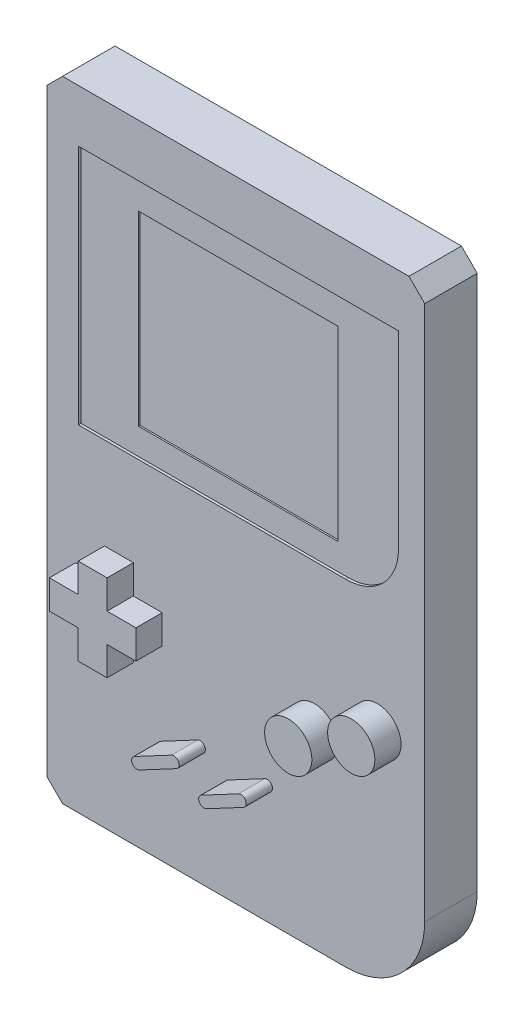
from build123d import *

# Parameters (mm, degrees)
SKETCH_1_R       = 4.5
EXTRUDE_10_DEPTH = 10
SKETCH_1_15_W    = 38
SKETCH_1_15_H    = 35.5
EXTRUDE_11_DEPTH = 9.5
SKETCH_1_16_W    = 38
SKETCH_1_16_H    = 35.5
EXTRUDE_12_DEPTH = 9.2
SKETCH_1_17_R    = 4.5
EXTRUDE_13_DEPTH = 15


with BuildPart() as part:
    # 草图1 → 凸台-拉伸10 (new body)
    with BuildSketch(Plane.XY):
        with BuildLine():
            Line((0, 117), (0, 3))
            Line((0, 3), (3, 0))
            Line((3, 0), (57, 0))
            ThreePointArc((57, 0), (67.606601718, 4.393398282), (72, 15))
            Line((72, 15), (72, 22.5))
            Line((72, 22.5), (72, 42))
            Line((72, 42), (72, 117))
            Line((72, 117), (69, 120))
            Line((69, 120), (3, 120))
            Line((3, 120), (0, 117))
        make_face()
        with BuildLine():
            ThreePointArc((22.625564011, 17.861279905), (21.273144855, 18.274755935), (21.686620885, 19.627175091))
            Line((21.686620885, 19.627175091), (28.750201628, 23.382947593))
            ThreePointArc((28.750201628, 23.382947593), (30.102620784, 22.969471563), (29.689144754, 21.617052407))
            Line((29.689144754, 21.617052407), (22.625564011, 17.861279905))
        make_face(mode=Mode.SUBTRACT)
        Polygon((10.9884201, 41.001199035), (10.9884201, 46.501199035), (16.4884201, 46.501199035), (16.4884201, 41.001199035), (21.9884201, 41.001199035), (21.9884201, 35.501199035), (16.4884201, 35.501199035), (16.4884201, 30.001199035), (10.9884201, 30.001199035), (10.9884201, 35.501199035), (5.4884201, 35.501199035), (5.4884201, 41.001199035), align=None, mode=Mode.SUBTRACT)
        with BuildLine():
            ThreePointArc((41.530528437, 23.382947593), (42.882947593, 22.969471563), (42.469471563, 21.617052407))
            Line((42.469471563, 21.617052407), (35.40589082, 17.861279905))
            ThreePointArc((35.40589082, 17.861279905), (34.053471664, 18.274755935), (34.466947694, 19.627175091))
            Line((34.466947694, 19.627175091), (41.530528437, 23.382947593))
        make_face(mode=Mode.SUBTRACT)
        with Locations((51, 36)):
            Circle(SKETCH_1_R, mode=Mode.SUBTRACT)
        with Locations((63, 42)):
            Circle(SKETCH_1_R, mode=Mode.SUBTRACT)
        with BuildLine():
            Line((6, 70.706412031), (6, 110))
            Line((6, 110), (67, 110))
            Line((67, 110), (67, 74))
            ThreePointArc((67, 74), (64.071067812, 66.928932188), (57, 64))
            Line((57, 64), (17, 64))
            Line((17, 64), (6, 64))
            Line((6, 64), (6, 70.706412031))
        make_face(mode=Mode.SUBTRACT)
    extrude(amount=EXTRUDE_10_DEPTH)

    # 草图1<15> → 凸台-拉伸11 (add)
    with BuildSketch(Plane.XY):
        with BuildLine():
            Line((67, 110), (6, 110))
            Line((6, 110), (6, 70.706412031))
            Line((6, 70.706412031), (6, 64))
            Line((6, 64), (17, 64))
            Line((17, 64), (57, 64))
            ThreePointArc((57, 64), (64.071067812, 66.928932188), (67, 74))
            Line((67, 74), (67, 110))
        make_face()
        with Locations((36, 86.75)):
            Rectangle(SKETCH_1_15_W, SKETCH_1_15_H, mode=Mode.SUBTRACT)
    extrude(amount=EXTRUDE_11_DEPTH)

    # 草图1<16> → 凸台-拉伸12 (add)
    with BuildSketch(Plane.XY):
        with Locations((36, 86.75)):
            Rectangle(SKETCH_1_16_W, SKETCH_1_16_H)
    extrude(amount=EXTRUDE_12_DEPTH)

    # 草图1<17> → 凸台-拉伸13 (add)
    with BuildSketch(Plane.XY):
        Polygon((16.4884201, 46.501199035), (10.9884201, 46.501199035), (10.9884201, 41.001199035), (5.4884201, 41.001199035), (5.4884201, 35.501199035), (10.9884201, 35.501199035), (10.9884201, 30.001199035), (16.4884201, 30.001199035), (16.4884201, 35.501199035), (21.9884201, 35.501199035), (21.9884201, 41.001199035), (16.4884201, 41.001199035), align=None)
        with BuildLine():
            Line((35.40589082, 17.861279905), (42.469471563, 21.617052407))
            ThreePointArc((42.469471563, 21.617052407), (42.882947593, 22.969471563), (41.530528437, 23.382947593))
            Line((41.530528437, 23.382947593), (34.466947694, 19.627175091))
            ThreePointArc((34.466947694, 19.627175091), (34.053471664, 18.274755935), (35.40589082, 17.861279905))
        make_face()
        with BuildLine():
            Line((28.750201628, 23.382947593), (21.686620885, 19.627175091))
            ThreePointArc((21.686620885, 19.627175091), (21.273144855, 18.274755935), (22.625564011, 17.861279905))
            Line((22.625564011, 17.861279905), (29.689144754, 21.617052407))
            ThreePointArc((29.689144754, 21.617052407), (30.102620784, 22.969471563), (28.750201628, 23.382947593))
        make_face()
        with Locations((63, 42)):
            Circle(SKETCH_1_17_R)
        with Locations((51, 36)):
            Circle(SKETCH_1_17_R)
    extrude(amount=EXTRUDE_13_DEPTH)


solid = part.part
